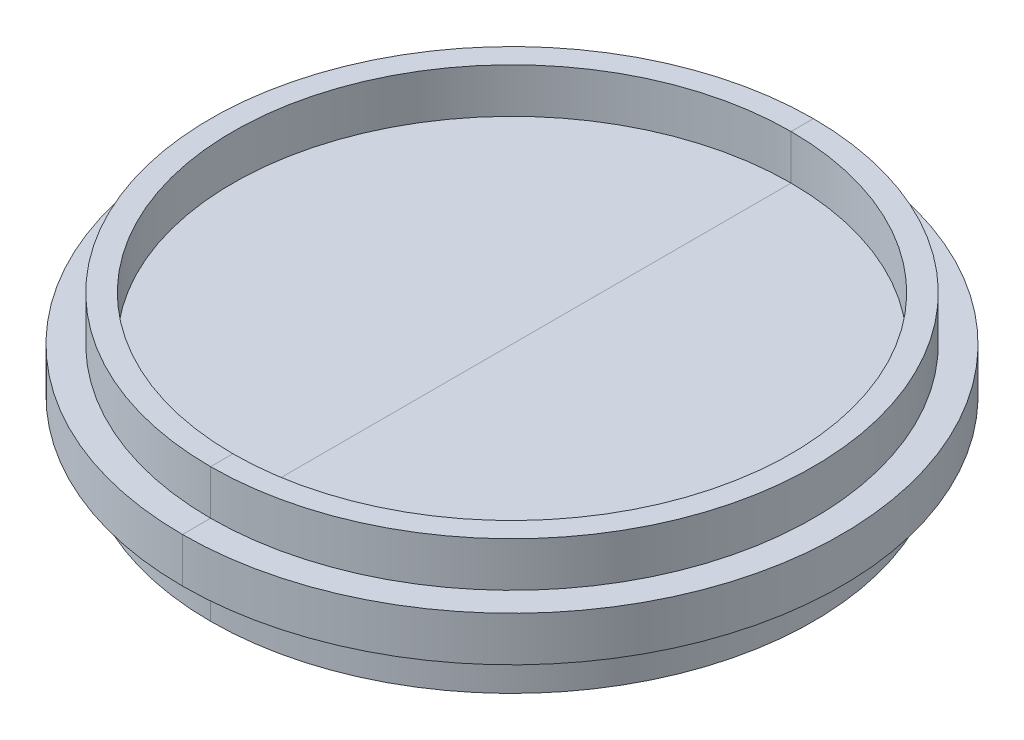
from build123d import *

# Parameters (mm, degrees)
SKETCH1_R            = 93.726
BOSS_EXTRUDE1_DEPTH  = 6.35
SKETCH5_R            = 85.725
SKETCH5_R_2          = 79.375
BOSS_EXTRUDE2_DEPTH  = 12.7
BOSS_EXTRUDE3_DEPTH  = 25.4
MIRROR5_COPY_1_DEPTH = 25.4
MIRROR5_COPY_2_DEPTH = 25.4


with BuildPart() as part:
    # Sketch1 → Boss-Extrude1 (new, symmetric)
    with BuildSketch(Plane(origin=(0, 0, 0), x_dir=(1, 0, 0), z_dir=(0, 1, 0))):
        with Locations(Location((0, 0, 0), (0, 0, 270))):
            Circle(SKETCH1_R)
    extrude(amount=BOSS_EXTRUDE1_DEPTH, both=True)

    # Sketch5 → Boss-Extrude2 (add)
    with BuildSketch(Plane(origin=(0, 6.35, 0), x_dir=(1, 0, 0), z_dir=(0, 1, 0))):
        with Locations(Location((0, 0, 0), (0, 0, 270))):
            Circle(SKETCH5_R)
        with Locations(Location((0, 0, 0), (0, 0, 270))):
            Circle(SKETCH5_R_2, mode=Mode.SUBTRACT)
    boss_extrude2 = extrude(amount=BOSS_EXTRUDE2_DEPTH)

    # Mirror1: Boss-Extrude2 across plane
    add(boss_extrude2.mirror(Plane.ZX))

    # Sketch7 → Boss-Extrude3 (add)
    with BuildSketch(Plane(origin=(0, 19.05, 0), x_dir=(1, 0, 0), z_dir=(0, 1, 0))):
        with BuildLine():
            Line((-25.787822327, 75.06916041), (-28.166257291, 80.965656764))
            ThreePointArc((-28.166257291, 80.965656764), (0, 85.725), (28.166257291, 80.965656764))
            Line((28.166257291, 80.965656764), (25.787822327, 75.06916041))
            ThreePointArc((25.787822327, 75.06916041), (0, 79.375), (-25.787822327, 75.06916041))
        make_face()
    boss_extrude3 = extrude(amount=-BOSS_EXTRUDE3_DEPTH)

    # Mirror3: Boss-Extrude3 across plane
    add(boss_extrude3.mirror(Plane.ZX))

    # Mirror4: Boss-Extrude3 across plane
    add(boss_extrude3.mirror(Plane.XY))

    # Mirror5 copy 1 sketch → Mirror5 copy 1 (add)
    with BuildSketch(Plane.XZ.offset(19.05)):
        with BuildLine():
            Line((-25.787822327, 75.06916041), (-28.166257291, 80.965656764))
            ThreePointArc((-28.166257291, 80.965656764), (0, 85.725), (28.166257291, 80.965656764))
            Line((28.166257291, 80.965656764), (25.787822327, 75.06916041))
            ThreePointArc((25.787822327, 75.06916041), (0, 79.375), (-25.787822327, 75.06916041))
        make_face()
    extrude(amount=-MIRROR5_COPY_1_DEPTH)

    # Mirror5 copy 2 sketch → Mirror5 copy 2 (add)
    with BuildSketch(Plane.XZ.offset(19.05)):
        with BuildLine():
            Line((-25.787822327, -75.06916041), (-28.166257291, -80.965656764))
            ThreePointArc((-28.166257291, -80.965656764), (0, -85.725), (28.166257291, -80.965656764))
            Line((28.166257291, -80.965656764), (25.787822327, -75.06916041))
            ThreePointArc((25.787822327, -75.06916041), (0, -79.375), (-25.787822327, -75.06916041))
        make_face()
    extrude(amount=-MIRROR5_COPY_2_DEPTH)


with BuildPart() as body_2:
    # Split1: the piece on the far side of the plane
    add(part.part)
    split(bisect_by=Plane(origin=(0, 0, 0), x_dir=(0, 0, 1), z_dir=(1, 0, 0)), keep=Keep.BOTTOM)


with BuildPart() as part_1:
    add(part.part)

    # Split1
    split(bisect_by=Plane(origin=(0, 0, 0), x_dir=(0, 0, 1), z_dir=(1, 0, 0)), keep=Keep.TOP)


solid = Compound([body_2.part, part_1.part])
